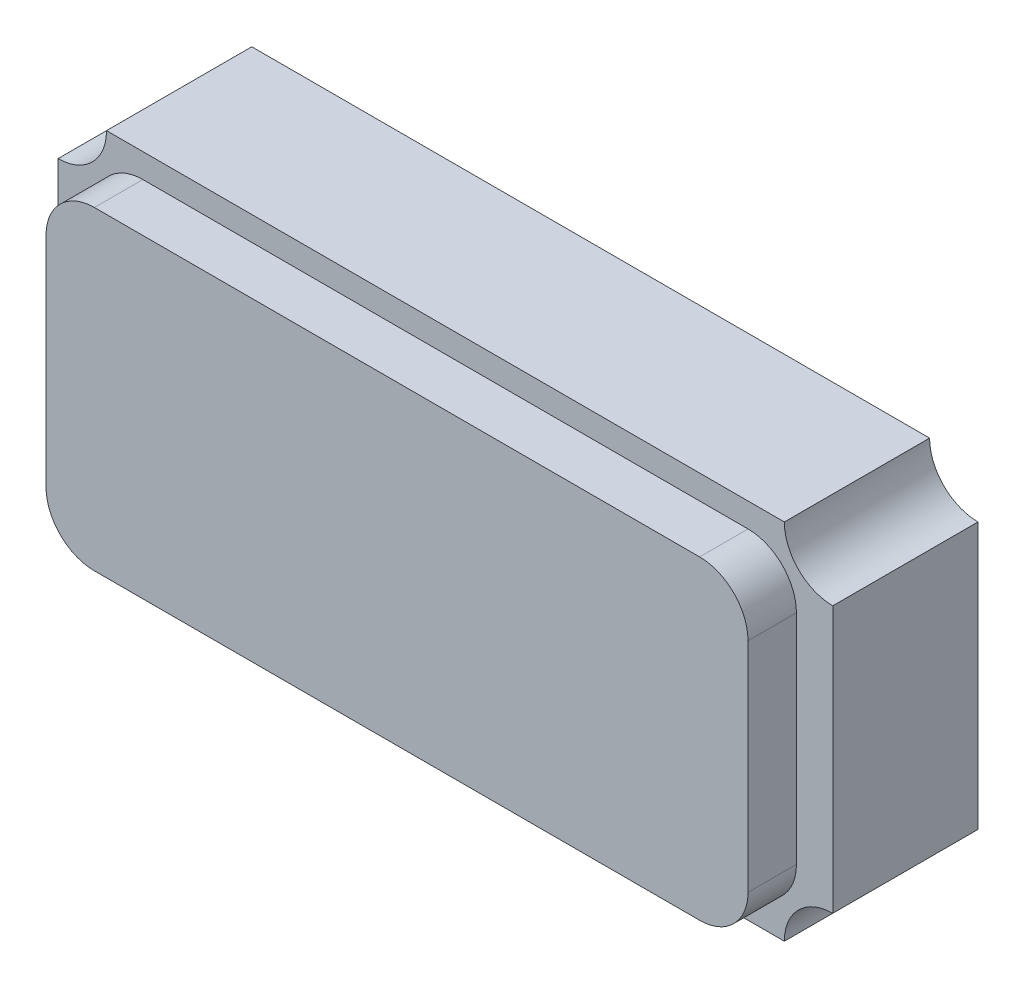
from build123d import *

# Parameters (mm, degrees)
SEMELLE_DEPTH   = 0.6
COUVERCLE_DEPTH = 0.2


with BuildPart() as part:
    # Esquisse1 → semelle (new body)
    with BuildSketch(Plane.XY):
        with BuildLine():
            Line((-1.6, -0.55), (-1.6, 0.55))
            ThreePointArc((-1.6, 0.55), (-1.458578644, 0.608578644), (-1.4, 0.75))
            Line((-1.4, 0.75), (1.4, 0.75))
            ThreePointArc((1.4, 0.75), (1.458578644, 0.608578644), (1.6, 0.55))
            Line((1.6, 0.55), (1.6, -0.55))
            ThreePointArc((1.6, -0.55), (1.458578644, -0.608578644), (1.4, -0.75))
            Line((1.4, -0.75), (-1.4, -0.75))
            ThreePointArc((-1.4, -0.75), (-1.458578644, -0.608578644), (-1.6, -0.55))
        make_face()
    extrude(amount=SEMELLE_DEPTH)

    # Esquisse2 → couvercle (add)
    with BuildSketch(Plane.XY.offset(0.6)):
        with BuildLine():
            Line((-1.25, 0.65), (1.25, 0.65))
            ThreePointArc((1.25, 0.65), (1.391421356, 0.591421356), (1.45, 0.45))
            Line((1.45, 0.45), (1.45, -0.45))
            ThreePointArc((1.45, -0.45), (1.391421356, -0.591421356), (1.25, -0.65))
            Line((1.25, -0.65), (-1.25, -0.65))
            ThreePointArc((-1.25, -0.65), (-1.391421356, -0.591421356), (-1.45, -0.45))
            Line((-1.45, -0.45), (-1.45, 0.45))
            ThreePointArc((-1.45, 0.45), (-1.391421356, 0.591421356), (-1.25, 0.65))
        make_face()
    extrude(amount=COUVERCLE_DEPTH)


solid = part.part
